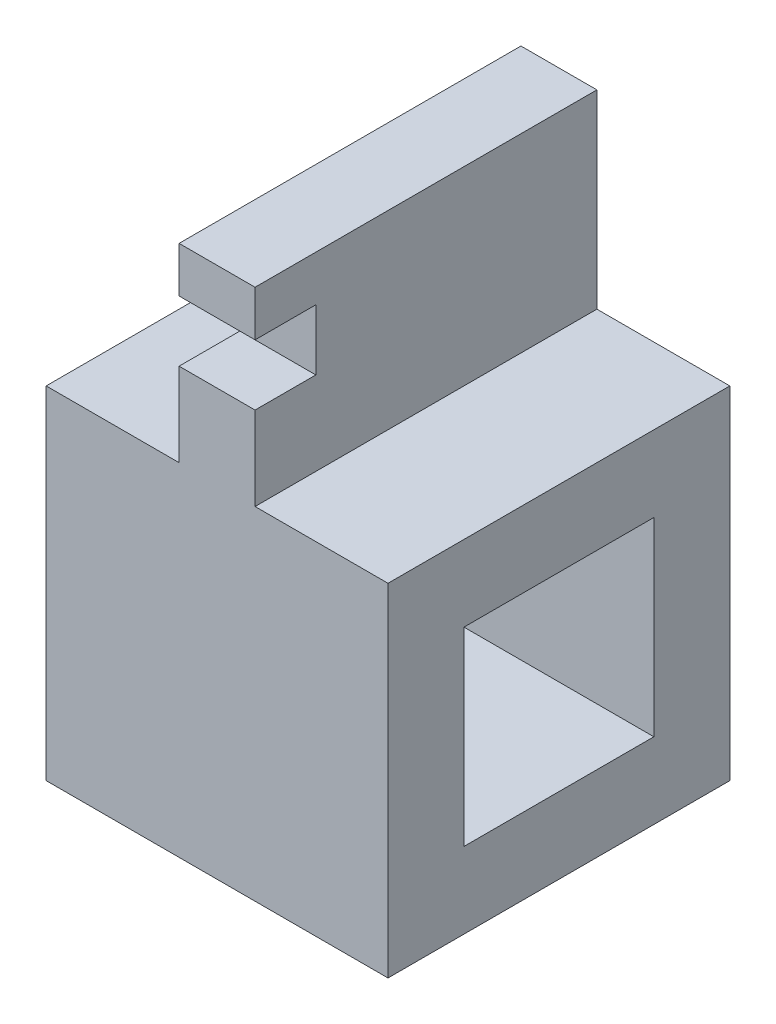
from build123d import *

# Parameters (mm, degrees)
SKETCH1_W           = 9
SKETCH1_H           = 9
SKETCH1_W_2         = 5
SKETCH1_H_2         = 5
BOSS_EXTRUDE1_DEPTH = 9
SKETCH2_W           = 2
SKETCH2_H           = 9
BOSS_EXTRUDE2_DEPTH = 5
SKETCH4_W           = 1.6
SKETCH4_H           = 1.6
CUT_EXTRUDE2_DEPTH  = 5


with BuildPart() as part:
    # Sketch1 → Boss-Extrude1 (new body)
    with BuildSketch(Plane(origin=(0, 0, 0), x_dir=(0, 0, -1), z_dir=(1, 0, 0))):
        Rectangle(SKETCH1_W, SKETCH1_H)
        Rectangle(SKETCH1_W_2, SKETCH1_H_2, mode=Mode.SUBTRACT)
    extrude(amount=BOSS_EXTRUDE1_DEPTH)

    # Sketch2 → Boss-Extrude2 (add)
    with BuildSketch(Plane(origin=(0, 4.5, 0), x_dir=(1, 0, 0), z_dir=(0, 1, 0))):
        with Locations((4.5, 0)):
            Rectangle(SKETCH2_W, SKETCH2_H)
    extrude(amount=BOSS_EXTRUDE2_DEPTH)

    # Sketch4 → Cut-Extrude2 (cut)
    with BuildSketch(Plane.ZY.offset(-3.5)):
        with Locations((3.7, 7.5)):
            Rectangle(SKETCH4_W, SKETCH4_H)
    extrude(amount=-CUT_EXTRUDE2_DEPTH, mode=Mode.SUBTRACT)


solid = part.part
